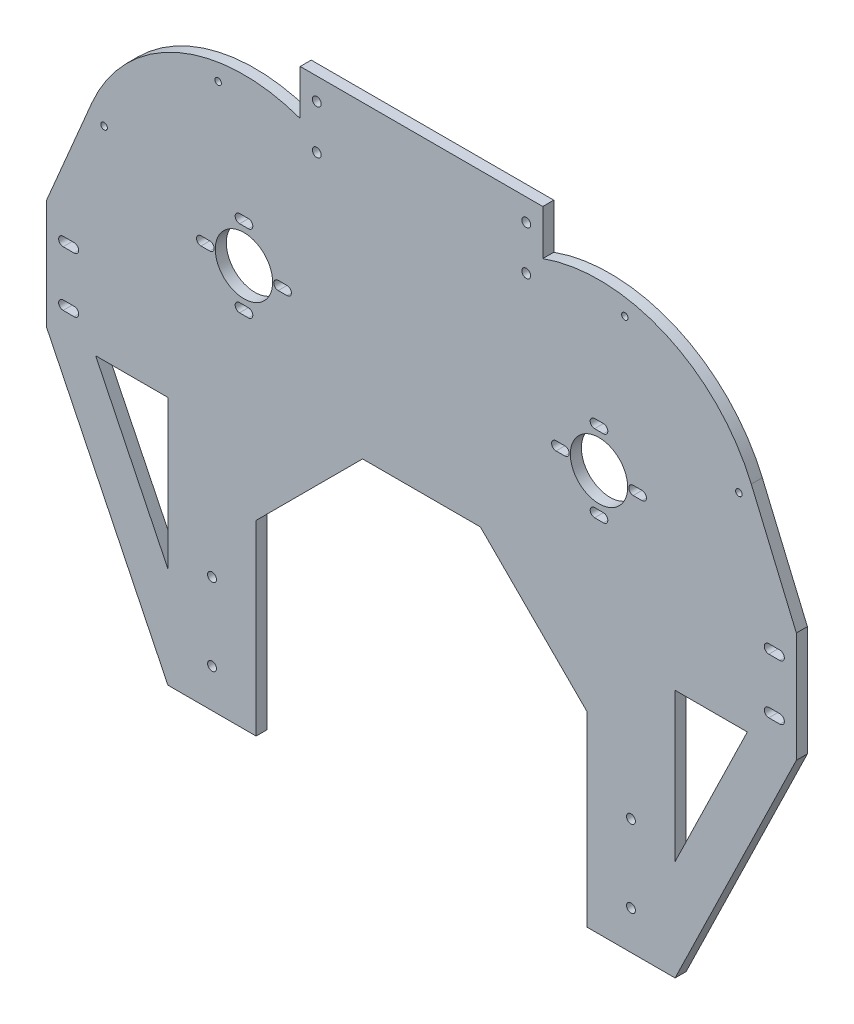
from build123d import *

# Parameters (mm, degrees)
SKETCH1_W           = 110
SKETCH1_H           = 140
SKETCH1_R           = 2
BOSS_EXTRUDE1_DEPTH = 5
SKETCH2_R           = 2
BOSS_EXTRUDE2_DEPTH = 5
SKETCH3_R           = 1.4732
SKETCH3_R_2         = 13
BOSS_EXTRUDE3_DEPTH = 5
BOSS_EXTRUDE4_DEPTH = 5


with BuildPart() as part:
    # Sketch1 → Boss-Extrude1 (new body)
    with BuildSketch(Plane.XY):
        Rectangle(SKETCH1_W, SKETCH1_H)
        with Locations((-47.5, 40)):
            Circle(SKETCH1_R, mode=Mode.SUBTRACT)
        with Locations((47.5, 40)):
            Circle(SKETCH1_R, mode=Mode.SUBTRACT)
        with Locations((-47.5, 60)):
            Circle(SKETCH1_R, mode=Mode.SUBTRACT)
        with Locations((47.5, 60)):
            Circle(SKETCH1_R, mode=Mode.SUBTRACT)
    extrude(amount=BOSS_EXTRUDE1_DEPTH)

    # Sketch2 → Boss-Extrude2 (add)
    with BuildSketch(Plane.XY):
        Polygon((-26.715730122, -70), (-55, -41.715730122), (-115, -101.715728753), (-115, -203), (-75, -203), (-75, -118.28427098), align=None)
        with Locations((-95, -185.5)):
            Circle(SKETCH2_R, mode=Mode.SUBTRACT)
        with Locations((-95, -150.5)):
            Circle(SKETCH2_R, mode=Mode.SUBTRACT)
    boss_extrude2 = extrude(amount=BOSS_EXTRUDE2_DEPTH)

    # Mirror1: Boss-Extrude2 across plane
    add(boss_extrude2.mirror(Plane(origin=(0, 0, 0), x_dir=(0, 0, 1), z_dir=(1, 0, 0))))

    # Sketch3 → Boss-Extrude3 (add)
    # profile 1 of 2: a face of its own
    with BuildSketch(Plane.XY.offset(5)):
        with BuildLine():
            ThreePointArc((-55, 49.531907673), (-151.188194001, 4.063503923), (-105.126050066, -91.841779044))
            Line((-105.126050066, -91.841779044), (-55, -41.715730122))
            Line((-55, -41.715730122), (-55, 49.531907673))
        make_face()
        with Locations((-143.929251903, 2.086359674)):
            Circle(SKETCH3_R, mode=Mode.SUBTRACT)
        with Locations((-92.221251993, 45.474523328)):
            Circle(SKETCH3_R, mode=Mode.SUBTRACT)
        with BuildLine():
            ThreePointArc((-65, -23), (-67, -21), (-65, -19))
            Line((-65, -19), (-61, -19))
            ThreePointArc((-61, -19), (-59, -21), (-61, -23))
            Line((-61, -23), (-65, -23))
        make_face(mode=Mode.SUBTRACT)
        with BuildLine():
            Line((-78.5, -40.5), (-82.5, -40.5))
            ThreePointArc((-82.5, -40.5), (-84.5, -38.5), (-82.5, -36.5))
            Line((-82.5, -36.5), (-78.5, -36.5))
            ThreePointArc((-78.5, -36.5), (-76.5, -38.5), (-78.5, -40.5))
        make_face(mode=Mode.SUBTRACT)
        with BuildLine():
            ThreePointArc((-96, -19), (-94, -21), (-96, -23))
            Line((-96, -23), (-100, -23))
            ThreePointArc((-100, -23), (-102, -21), (-100, -19))
            Line((-100, -19), (-96, -19))
        make_face(mode=Mode.SUBTRACT)
        with Locations((-80.5, -21)):
            Circle(SKETCH3_R_2, mode=Mode.SUBTRACT)
        with BuildLine():
            ThreePointArc((-82.5, -5.5), (-84.5, -3.5), (-82.5, -1.5))
            Line((-82.5, -1.5), (-78.5, -1.5))
            ThreePointArc((-78.5, -1.5), (-76.5, -3.5), (-78.5, -5.5))
            Line((-78.5, -5.5), (-82.5, -5.5))
        make_face(mode=Mode.SUBTRACT)
    # profile 2 of 2: a face of its own
    with BuildSketch(Plane.XY.offset(5)):
        with BuildLine():
            ThreePointArc((105.126050066, -91.841779044), (151.188194001, 4.063503923), (55, 49.531907673))
            Line((55, 49.531907673), (55, -41.715730122))
            Line((55, -41.715730122), (105.126050066, -91.841779044))
        make_face()
        with Locations((143.929251903, 2.086359674)):
            Circle(SKETCH3_R, mode=Mode.SUBTRACT)
        with Locations((92.221251993, 45.474523328)):
            Circle(SKETCH3_R, mode=Mode.SUBTRACT)
        with BuildLine():
            ThreePointArc((82.5, -1.5), (84.5, -3.5), (82.5, -5.5))
            Line((82.5, -5.5), (78.5, -5.5))
            ThreePointArc((78.5, -5.5), (76.5, -3.5), (78.5, -1.5))
            Line((78.5, -1.5), (82.5, -1.5))
        make_face(mode=Mode.SUBTRACT)
        with BuildLine():
            ThreePointArc((65, -19), (67, -21), (65, -23))
            Line((65, -23), (61, -23))
            ThreePointArc((61, -23), (59, -21), (61, -19))
            Line((61, -19), (65, -19))
        make_face(mode=Mode.SUBTRACT)
        with BuildLine():
            ThreePointArc((82.5, -36.5), (84.5, -38.5), (82.5, -40.5))
            Line((82.5, -40.5), (78.5, -40.5))
            ThreePointArc((78.5, -40.5), (76.5, -38.5), (78.5, -36.5))
            Line((78.5, -36.5), (82.5, -36.5))
        make_face(mode=Mode.SUBTRACT)
        with Locations((80.5, -21)):
            Circle(SKETCH3_R_2, mode=Mode.SUBTRACT)
        with BuildLine():
            Line((100, -23), (96, -23))
            ThreePointArc((96, -23), (94, -21), (96, -19))
            Line((96, -19), (100, -19))
            ThreePointArc((100, -19), (102, -21), (100, -23))
        make_face(mode=Mode.SUBTRACT)
    extrude(amount=-BOSS_EXTRUDE3_DEPTH)

    # Sketch4 → Boss-Extrude4 (add)
    with BuildSketch(Plane.XY.offset(5)):
        with BuildLine():
            Line((-170, -90), (-115, -203))
            Line((-115, -203), (-115, -157.300297485))
            Line((-115, -157.300297485), (-147.756781962, -90))
            Line((-147.756781962, -90), (-115, -90))
            Line((-115, -90), (-115, -101.715728753))
            Line((-115, -101.715728753), (-100, -101.715728753))
            Line((-100, -101.715728753), (-100, -90))
            Line((-100, -90), (-100, -40))
            Line((-100, -40), (-153.053428589, -40))
            ThreePointArc((-153.053428589, -40), (-155.304162069, -15.583604777), (-149.559478858, 8.253860938))
            Line((-149.559478858, 8.253860938), (-170, -40))
            Line((-170, -40), (-170, -90))
        make_face()
        with BuildLine():
            Line((-157.5, -54.55), (-162.5, -54.55))
            ThreePointArc((-162.5, -54.55), (-164.55, -52.5), (-162.5, -50.45))
            Line((-162.5, -50.45), (-157.5, -50.45))
            ThreePointArc((-157.5, -50.45), (-155.45, -52.5), (-157.5, -54.55))
        make_face(mode=Mode.SUBTRACT)
        with BuildLine():
            Line((-157.5, -75.45), (-162.5, -75.45))
            ThreePointArc((-162.5, -75.45), (-164.55, -77.5), (-162.5, -79.55))
            Line((-162.5, -79.55), (-157.5, -79.55))
            ThreePointArc((-157.5, -79.55), (-155.45, -77.5), (-157.5, -75.45))
        make_face(mode=Mode.SUBTRACT)
    boss_extrude4 = extrude(amount=-BOSS_EXTRUDE4_DEPTH)

    # Mirror2: Boss-Extrude4 across plane
    add(boss_extrude4.mirror(Plane(origin=(0, 0, 0), x_dir=(0, 0, 1), z_dir=(1, 0, 0))))


solid = part.part
